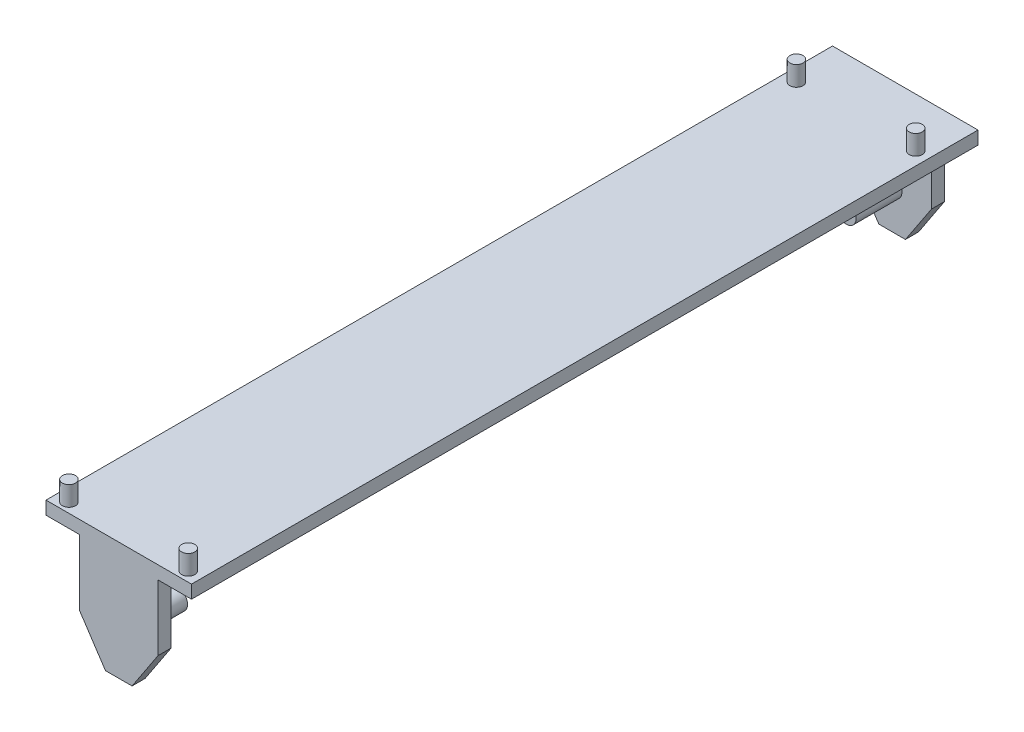
from build123d import *

# Parameters (mm, degrees)
BOSS_EXTRUDE1_DEPTH = 10
SKETCH1_3_R         = 7.5
BOSS_EXTRUDE2_DEPTH = 35
SKETCH3_W           = 111
SKETCH3_H           = 10
BOSS_EXTRUDE3_DEPTH = 300
SKETCH4_R           = 5
BOSS_EXTRUDE4_DEPTH = 15


with BuildPart() as part:
    # Sketch1 → Boss-Extrude1 (new body)
    with BuildSketch(Plane.XY):
        Polygon((10.143306561, -30), (30, 0), (30, 50), (-30, 50), (-30, 0), (-10.143306561, -30), align=None)
    boss_extrude1 = extrude(amount=BOSS_EXTRUDE1_DEPTH)

    # Sketch1<3> → Boss-Extrude2 (add)
    with BuildSketch(Plane.XY):
        Circle(SKETCH1_3_R)
    boss_extrude2 = extrude(amount=-BOSS_EXTRUDE2_DEPTH)

    # Sketch3 → Boss-Extrude3 (add)
    with BuildSketch(Plane.XY.offset(10)):
        with Locations((0, 55)):
            Rectangle(SKETCH3_W, SKETCH3_H)
    boss_extrude3 = extrude(amount=-BOSS_EXTRUDE3_DEPTH)

    # Mirror1: Boss-Extrude1, Boss-Extrude2, Boss-Extrude3 across plane
    add(boss_extrude1.mirror(Plane(origin=(0, 0, -290), x_dir=(1, 0, 0), z_dir=(0, 0, -1))))
    add(boss_extrude2.mirror(Plane(origin=(0, 0, -290), x_dir=(1, 0, 0), z_dir=(0, 0, -1))))
    add(boss_extrude3.mirror(Plane(origin=(0, 0, -290), x_dir=(1, 0, 0), z_dir=(0, 0, -1))))

    # Sketch4 → Boss-Extrude4 (add)
    with BuildSketch(Plane(origin=(0, 60, 0), x_dir=(1, 0, 0), z_dir=(0, 1, 0))):
        with Locations((-45.5, -2.5)):
            Circle(SKETCH4_R)
        with Locations((45.5, -2.5)):
            Circle(SKETCH4_R)
        with Locations((-45.5, 552.5)):
            Circle(SKETCH4_R)
        with Locations((45.5, 552.5)):
            Circle(SKETCH4_R)
    extrude(amount=BOSS_EXTRUDE4_DEPTH)


solid = part.part
